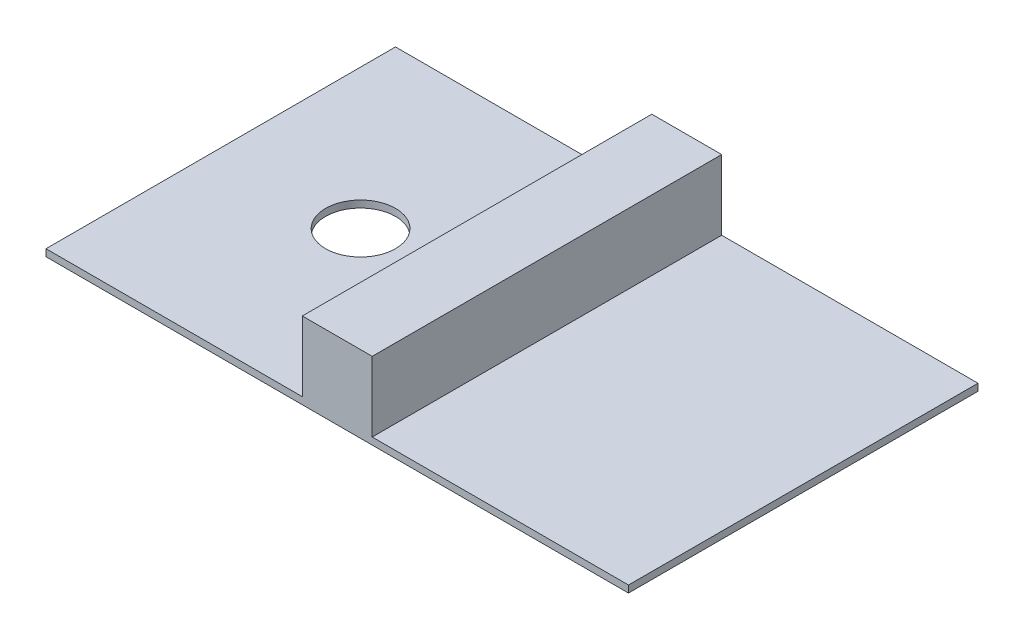
from build123d import *

# Parameters (mm, degrees)
SKETCH1_W           = 25
SKETCH1_H           = 15
BOSS_EXTRUDE1_DEPTH = 0.3
SKETCH2_W           = 3
SKETCH2_H           = 15
BOSS_EXTRUDE2_DEPTH = 3
SKETCH2_5_R         = 1.5
CUT_EXTRUDE1_DEPTH  = 3


with BuildPart() as part:
    # Sketch1 → Boss-Extrude1 (new body)
    with BuildSketch(Plane(origin=(0, 0, 0), x_dir=(1, 0, 0), z_dir=(0, 1, 0))):
        with Locations((12.5, 7.5)):
            Rectangle(SKETCH1_W, SKETCH1_H)
    extrude(amount=BOSS_EXTRUDE1_DEPTH)

    # Sketch2 → Boss-Extrude2 (add)
    with BuildSketch(Plane(origin=(0, 0.3, 0), x_dir=(1, 0, 0), z_dir=(0, 1, 0))):
        with Locations((12.5, 7.5)):
            Rectangle(SKETCH2_W, SKETCH2_H)
    extrude(amount=BOSS_EXTRUDE2_DEPTH)

    # Sketch2<5> → Cut-Extrude1 (cut)
    with BuildSketch(Plane(origin=(0, 0.3, 0), x_dir=(1, 0, 0), z_dir=(0, 1, 0))):
        with Locations((6, 7.5)):
            Circle(SKETCH2_5_R)
    extrude(amount=-CUT_EXTRUDE1_DEPTH, mode=Mode.SUBTRACT)


solid = part.part
